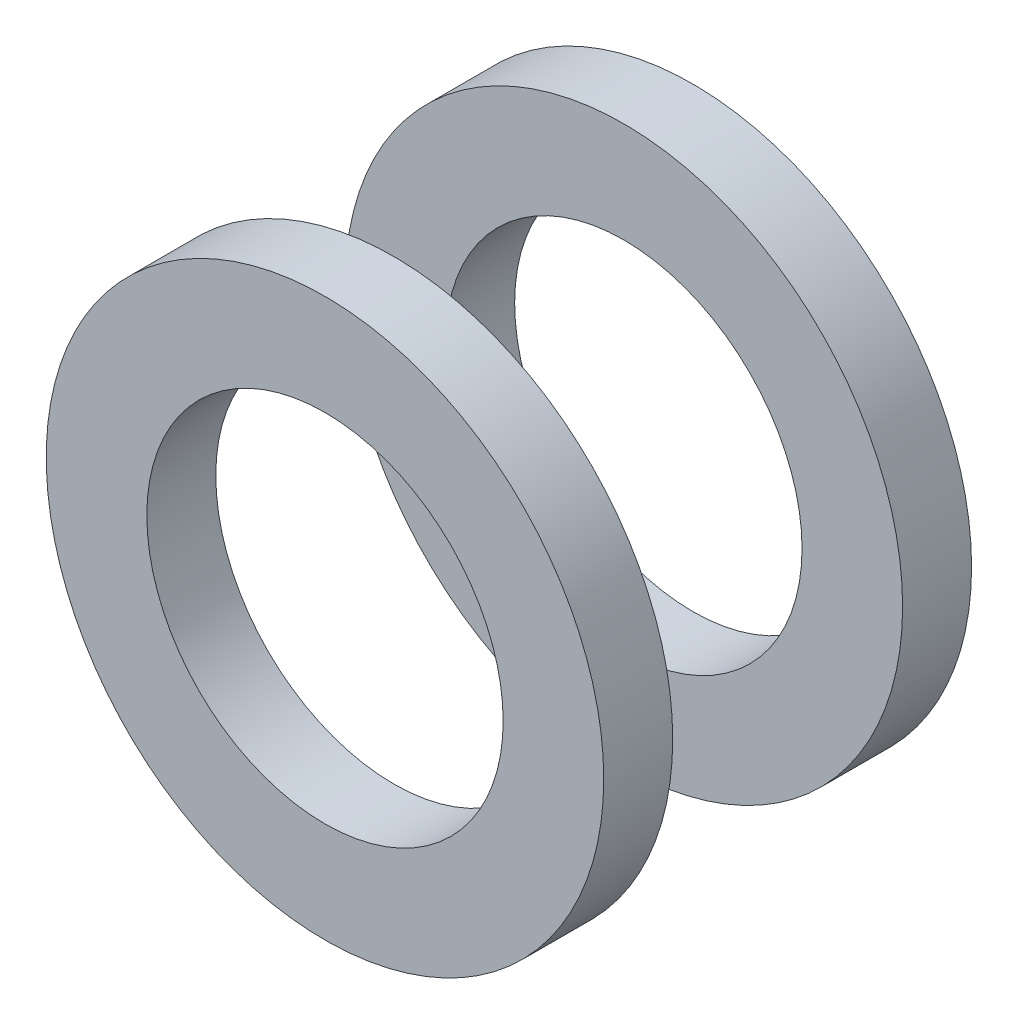
from build123d import *

# Parameters (mm, degrees)
REAR_ENDTURN_START  = -32
SKETCH_1_R          = 48.5
SKETCH_1_R_2        = 31
REAR_ENDTURN_DEPTH  = 12
FRONT_ENDTURN_START = 20
SKETCH_2_R          = 48.5
SKETCH_2_R_2        = 31
FRONT_ENDTURN_DEPTH = 12


with BuildPart() as part:
    # Эскиз1 → Rear_endturn (new body)
    with BuildSketch(Plane.XY.offset(REAR_ENDTURN_START)):
        Circle(SKETCH_1_R)
        Circle(SKETCH_1_R_2, mode=Mode.SUBTRACT)
    extrude(amount=REAR_ENDTURN_DEPTH)


with BuildPart() as body_2:
    # Эскиз2 → Front_endturn (new body)
    with BuildSketch(Plane.XY.offset(FRONT_ENDTURN_START)):
        Circle(SKETCH_2_R)
        Circle(SKETCH_2_R_2, mode=Mode.SUBTRACT)
    extrude(amount=FRONT_ENDTURN_DEPTH)


solid = Compound([part.part, body_2.part])
